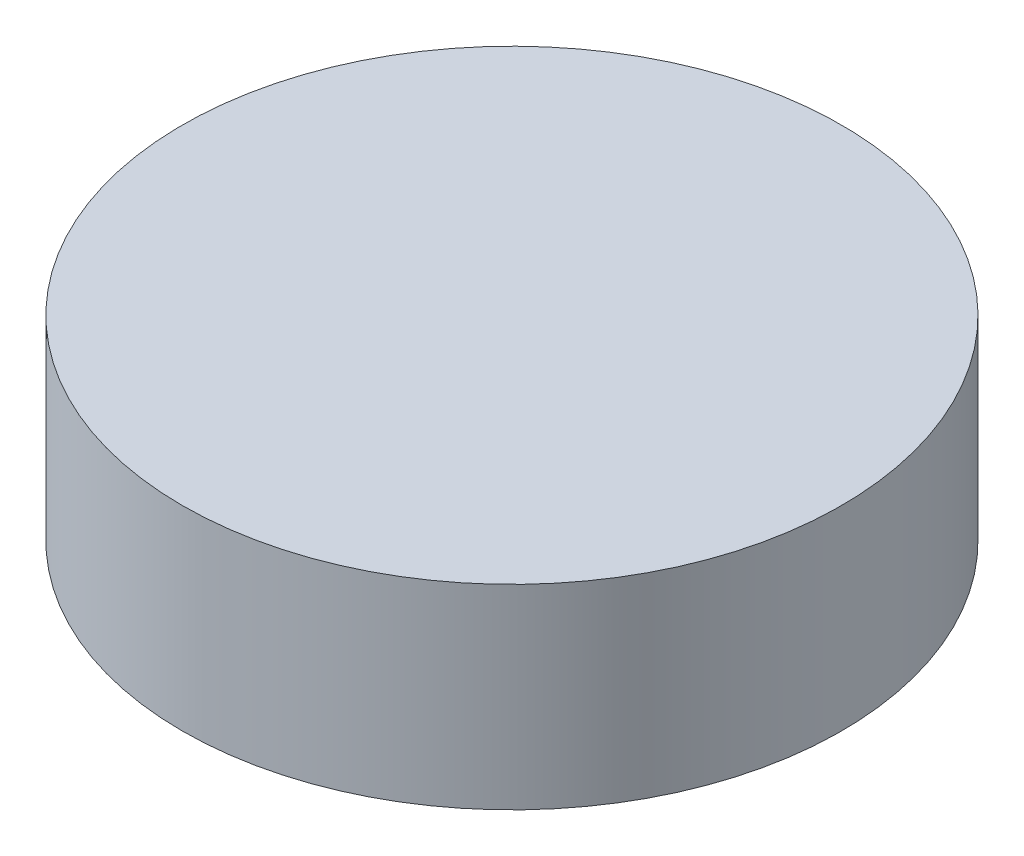
from build123d import *

# Parameters (mm, degrees)
SKETCH1_R           = 67.5
BOSS_EXTRUDE1_DEPTH = 40


with BuildPart() as part:
    # Sketch1 → Boss-Extrude1 (new body)
    with BuildSketch(Plane(origin=(0, 0, 0), x_dir=(1, 0, 0), z_dir=(0, 1, 0))):
        with Locations(Location((0, 0, 0), (0, 0, 270))):
            Circle(SKETCH1_R)
    extrude(amount=BOSS_EXTRUDE1_DEPTH)


solid = part.part
